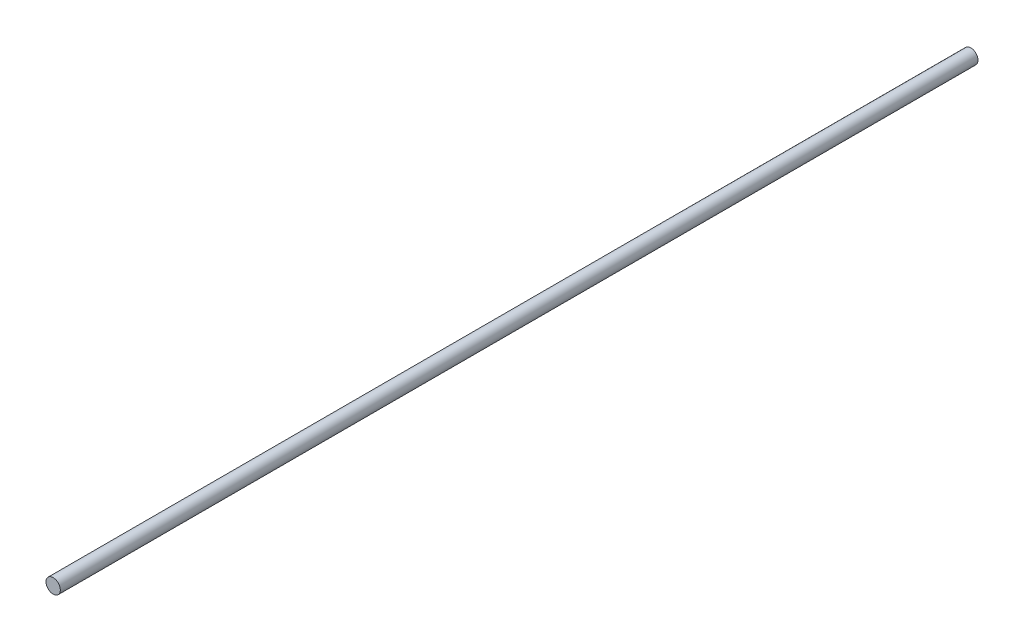
from build123d import *

# Parameters (mm, degrees)
SKETCH1_R           = 2.5
BOSS_EXTRUDE1_DEPTH = 320


with BuildPart() as part:
    # Sketch1 → Boss-Extrude1 (new body)
    with BuildSketch(Plane.XY):
        Circle(SKETCH1_R)
    extrude(amount=BOSS_EXTRUDE1_DEPTH)


solid = part.part
